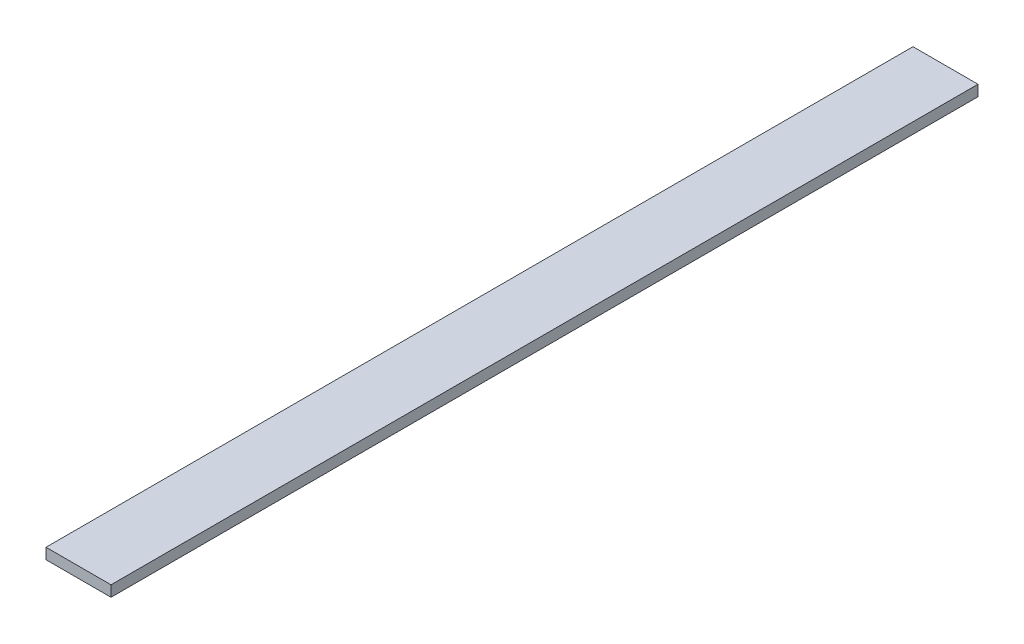
from build123d import *

# Parameters (mm, degrees)
SKETCH_13_W     = 15
SKETCH_13_H     = 200
EXTRUDE_4_DEPTH = 2.5


with BuildPart() as part:
    # 草图13 → 凸台-拉伸4 (new body)
    with BuildSketch(Plane(origin=(0, 0, 0), x_dir=(1, 0, 0), z_dir=(0, 1, 0))):
        with Locations((7.5, -100)):
            Rectangle(SKETCH_13_W, SKETCH_13_H)
    extrude(amount=EXTRUDE_4_DEPTH)


solid = part.part
